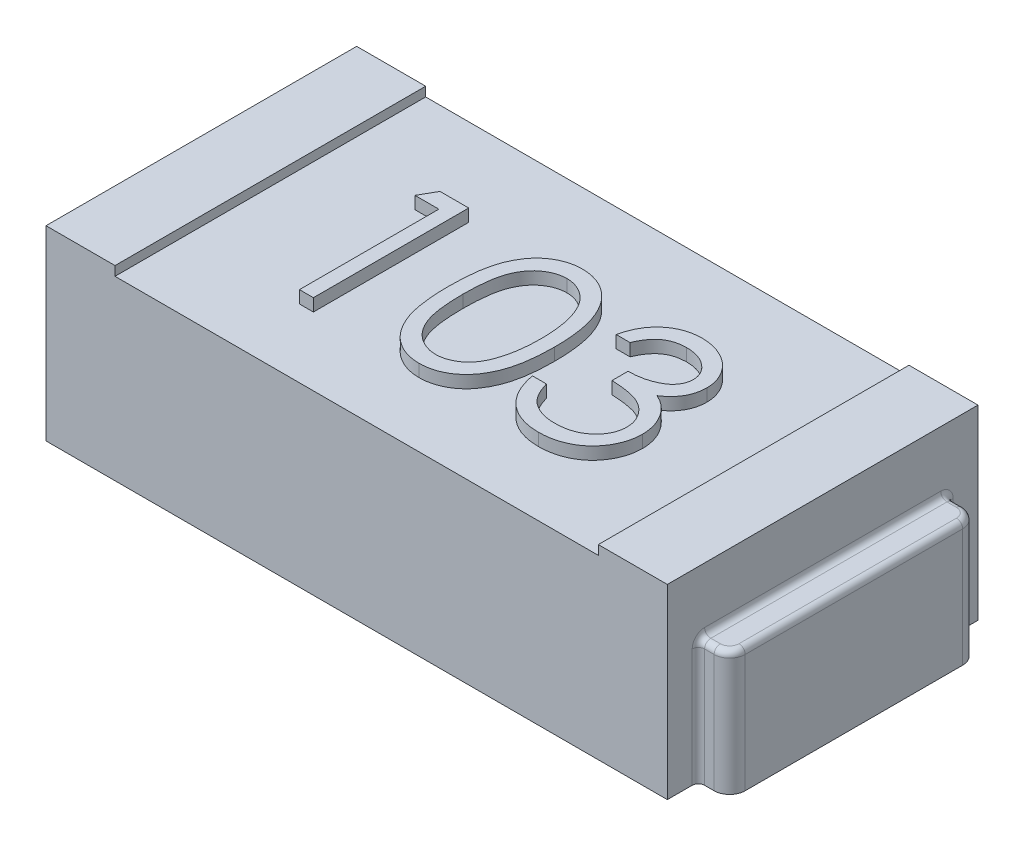
from build123d import *

# Parameters (mm, degrees)
ESQUISSE1_W             = 2
ESQUISSE1_H             = 1
BOSS_EXTRU_1_DEPTH      = 0.6
ESQUISSE2_W             = 1.555645222
ESQUISSE2_H             = 1
ENL_V_MAT_EXTRU_1_DEPTH = 0.03
BOSS_EXTRU_2_DEPTH      = 0.4
CONG_1_R                = 0.02
CONG_1_OF_SYM_TRIE2_R   = 0.02
BOSS_EXTRU_3_DEPTH      = 0.04


with BuildPart() as part:
    # Esquisse1 → Boss.-Extru.1 (new body)
    with BuildSketch(Plane(origin=(0, 0, 0), x_dir=(1, 0, 0), z_dir=(0, 1, 0))):
        Rectangle(ESQUISSE1_W, ESQUISSE1_H)
    extrude(amount=BOSS_EXTRU_1_DEPTH)

    # Esquisse2 → Enlèv. mat.-Extru.1 (cut)
    with BuildSketch(Plane(origin=(0, 0.6, 0), x_dir=(1, 0, 0), z_dir=(0, 1, 0))):
        Rectangle(ESQUISSE2_W, ESQUISSE2_H)
    extrude(amount=-ENL_V_MAT_EXTRU_1_DEPTH, mode=Mode.SUBTRACT)

    # Esquisse3 → Boss.-Extru.2 (add)
    with BuildSketch(Plane(origin=(0, 0, 0), x_dir=(1, 0, 0), z_dir=(0, 1, 0))):
        with BuildLine():
            Line((1, 0.4), (1.050552667, 0.4))
            ThreePointArc((1.050552667, 0.4), (1.085908006, 0.385355339), (1.100552667, 0.35))
            Line((1.100552667, 0.35), (1.100552667, -0.35))
            ThreePointArc((1.100552667, -0.35), (1.085908006, -0.385355339), (1.050552667, -0.4))
            Line((1.050552667, -0.4), (1, -0.4))
            Line((1, -0.4), (1, 0.4))
        make_face()
    boss_extru_2 = extrude(amount=BOSS_EXTRU_2_DEPTH)

    # Congé1
    cong_1_edges = [part.edges().sort_by_distance(p)[0] for p in [
        (1, 0.2, -0.4),
        (1, 0.2, 0.4),
        (1, 0.4, 0),
        (1.025276334, 0.4, 0.4),
        (1.085908006, 0.4, 0.385355339),
        (1.100552667, 0.4, 0),
        (1.085908006, 0.4, -0.385355339),
        (1.025276334, 0.4, -0.4),
    ]]
    fillet(cong_1_edges, radius=CONG_1_R)

    # Symétrie2: Boss.-Extru.2 across plane
    add(boss_extru_2.mirror(Plane(origin=(0, 0, 0), x_dir=(0, 0, 1), z_dir=(1, 0, 0))))

    # Congé1 of Symétrie2
    cong_1_of_sym_trie2_edges = [part.edges().sort_by_distance(p)[0] for p in [
        (-1, 0.2, -0.4),
        (-1, 0.2, 0.4),
        (-1, 0.4, 0),
        (-1.025276334, 0.4, 0.4),
        (-1.085908006, 0.4, 0.385355339),
        (-1.100552667, 0.4, 0),
        (-1.085908006, 0.4, -0.385355339),
        (-1.025276334, 0.4, -0.4),
    ]]
    fillet(cong_1_of_sym_trie2_edges, radius=CONG_1_OF_SYM_TRIE2_R)

    # Esquisse4 → Boss.-Extru.3 (add)
    # profile 1 of 3: a face of its own
    with BuildSketch(Plane(origin=(0, 0.57, 0), x_dir=(1, 0, 0), z_dir=(0, 1, 0))):
        with BuildLine():
            Line((0.275641026, 0.104315862), (0.230769231, 0.104315862))
            add(Edge.make_bspline(
                [(0.230769231, 0.104315862), (0.231984881, 0.109349074), (0.234361377, 0.119188592), (0.239318174, 0.133246772), (0.244718067, 0.146550132), (0.251202225, 0.158849571), (0.258274904, 0.170392272), (0.26637815, 0.180916432), (0.27513811, 0.190689713), (0.284827389, 0.199363033), (0.294988626, 0.207216994), (0.305765001, 0.213913431), (0.3169397, 0.219674024), (0.328590147, 0.224419771), (0.340751029, 0.227994846), (0.353312404, 0.230588676), (0.366307189, 0.23227312), (0.375128274, 0.232437515), (0.379607372, 0.23252099)],
                knots=[0, 0, 0, 0, 1.162005537, 2.271625781, 3.343758855, 4.383309926, 5.390229558, 6.379919256, 7.361854164, 8.333198761, 9.295911338, 10.242430842, 11.177959212, 12.116337295, 13.062827104, 14.020064771, 14.994644689, 16, 16, 16, 16], degree=3))
            add(Edge.make_bspline(
                [(0.379607372, 0.23252099), (0.386133478, 0.232323957), (0.399043337, 0.231934189), (0.418009486, 0.228374984), (0.436299032, 0.222742822), (0.453711781, 0.214960861), (0.469885843, 0.205362674), (0.484276727, 0.19393914), (0.496689371, 0.180910668), (0.507102854, 0.166520302), (0.515256425, 0.151140943), (0.521268764, 0.13531235), (0.524929004, 0.119072068), (0.52540337, 0.108106742), (0.525641026, 0.102613138)],
                knots=[0, 0, 0, 0, 1.083050992, 2.142477498, 3.193116406, 4.255571735, 5.30263384, 6.308962982, 7.297363603, 8.282367274, 9.249857812, 10.179914175, 11.08814088, 12, 12, 12, 12], degree=3))
            add(Edge.make_bspline(
                [(0.525641026, 0.102613138), (0.525474798, 0.097326453), (0.525149517, 0.086981231), (0.522387559, 0.07187816), (0.517739522, 0.057643645), (0.511300984, 0.044217765), (0.502966477, 0.031685645), (0.492870378, 0.020019089), (0.480941426, 0.009166352), (0.471901578, 0.002949285), (0.467247596, -0.000251446)],
                knots=[0, 0, 0, 0, 1.024540389, 2.004866551, 2.965041327, 3.920577974, 4.882998113, 5.874504559, 6.905732034, 8, 8, 8, 8], degree=3))
            add(Edge.make_bspline(
                [(0.467247596, -0.000251446), (0.472566418, -0.002819756), (0.483104543, -0.007908321), (0.497468904, -0.017887715), (0.510508601, -0.029410051), (0.517780561, -0.038401858), (0.521434295, -0.042919715)],
                knots=[0, 0, 0, 0, 1.015518401, 2.012035669, 3.001164323, 4, 4, 4, 4], degree=3))
            add(Edge.make_bspline(
                [(0.521434295, -0.042919715), (0.523840201, -0.046213679), (0.528612615, -0.052747668), (0.534503405, -0.063252871), (0.539847564, -0.073874513), (0.544011881, -0.084897285), (0.54723672, -0.09619343), (0.549541867, -0.107782343), (0.550973887, -0.119673489), (0.551178966, -0.127718129), (0.551282051, -0.131761862)],
                knots=[0, 0, 0, 0, 1.025084078, 2.033381695, 3.024893161, 4.013698104, 4.991890475, 5.976764909, 6.982997093, 8, 8, 8, 8], degree=3))
            add(Edge.make_bspline(
                [(0.551282051, -0.131761862), (0.551025692, -0.138763251), (0.55051418, -0.15273308), (0.54594217, -0.173372326), (0.538854564, -0.193547398), (0.528789287, -0.212843803), (0.516522501, -0.230898143), (0.501928597, -0.247051902), (0.485173396, -0.260937417), (0.466486875, -0.272538878), (0.446241571, -0.281812867), (0.424587915, -0.288249644), (0.401837907, -0.29244193), (0.386236864, -0.292891483), (0.378305288, -0.293120035)],
                knots=[0, 0, 0, 0, 0.955779014, 1.907060117, 2.875433937, 3.871313158, 4.872415639, 5.851225146, 6.836215519, 7.83643374, 8.849228613, 9.86973379, 10.916971861, 12, 12, 12, 12], degree=3))
            add(Edge.make_bspline(
                [(0.378305288, -0.293120035), (0.372959674, -0.292996005), (0.362441288, -0.292751954), (0.346977931, -0.291083583), (0.332217688, -0.288036439), (0.318140603, -0.283935967), (0.304734169, -0.278737147), (0.292039297, -0.272263047), (0.279977883, -0.264647118), (0.268663747, -0.255799463), (0.258098238, -0.245902128), (0.248562134, -0.234779413), (0.23989645, -0.222636926), (0.232333215, -0.209333633), (0.225527937, -0.195041453), (0.219930657, -0.179577382), (0.215004147, -0.163079664), (0.212713652, -0.151582844), (0.211538462, -0.145684138)],
                knots=[0, 0, 0, 0, 1.048658725, 2.063410685, 3.046034179, 4.001477787, 4.936774919, 5.862367409, 6.792675028, 7.730719943, 8.675894397, 9.627829632, 10.600096036, 11.597688215, 12.626045268, 13.701542398, 14.82072376, 16, 16, 16, 16], degree=3))
            Line((0.211538462, -0.145684138), (0.256410256, -0.145684138))
            add(Edge.make_bspline(
                [(0.256410256, -0.145684138), (0.257579298, -0.149533997), (0.259853186, -0.157022307), (0.2637238, -0.167799494), (0.268133553, -0.177679216), (0.272864204, -0.186733947), (0.277832553, -0.195052862), (0.283391828, -0.202415986), (0.289130278, -0.209146729), (0.2934559, -0.212938817), (0.295572917, -0.214794715)],
                knots=[0, 0, 0, 0, 1.198163088, 2.33053128, 3.407730985, 4.417276592, 5.372219308, 6.28897303, 7.162600585, 8, 8, 8, 8], degree=3))
            add(Edge.make_bspline(
                [(0.295572917, -0.214794715), (0.298372428, -0.216953048), (0.303962808, -0.221263053), (0.313072555, -0.226763286), (0.322653253, -0.231529146), (0.332912492, -0.235169674), (0.343628888, -0.238252197), (0.354975655, -0.240269414), (0.366852686, -0.241653439), (0.374962366, -0.241775572), (0.379106571, -0.241837984)],
                knots=[0, 0, 0, 0, 0.946170439, 1.889420265, 2.845303464, 3.807233317, 4.801018734, 5.828864929, 6.890507805, 8, 8, 8, 8], degree=3))
            add(Edge.make_bspline(
                [(0.379106571, -0.241837984), (0.383785642, -0.241749998), (0.392935163, -0.241577948), (0.406285857, -0.239995704), (0.418986921, -0.237691359), (0.430897339, -0.234132362), (0.442173126, -0.229735097), (0.452656219, -0.224213896), (0.462484234, -0.217736079), (0.471531292, -0.210373342), (0.479666365, -0.202313128), (0.486829152, -0.19388269), (0.49291839, -0.185117571), (0.497830329, -0.175969268), (0.501708979, -0.166475664), (0.504349437, -0.156610117), (0.506185367, -0.146453365), (0.506334883, -0.139549226), (0.506410256, -0.136068753)],
                knots=[0, 0, 0, 0, 1.217147791, 2.380027433, 3.494444702, 4.572153297, 5.609568379, 6.639424714, 7.649109417, 8.668170816, 9.669597737, 10.625200337, 11.543417969, 12.441394052, 13.322311151, 14.205496177, 15.095365482, 16, 16, 16, 16], degree=3))
            add(Edge.make_bspline(
                [(0.506410256, -0.136068753), (0.506191642, -0.131409991), (0.505755501, -0.122115647), (0.502425704, -0.108441707), (0.496948723, -0.095266934), (0.489281221, -0.082816107), (0.479947546, -0.071276693), (0.469038273, -0.060980767), (0.456462812, -0.052485039), (0.444888545, -0.046615231), (0.43463638, -0.042609935), (0.425862754, -0.039942083), (0.416040382, -0.037682989), (0.405288046, -0.035581236), (0.39352473, -0.033792472), (0.380763238, -0.032300784), (0.367000987, -0.031107207), (0.357473677, -0.030574193), (0.352564103, -0.030299523)],
                knots=[0, 0, 0, 0, 1.07054697, 2.135767047, 3.216561865, 4.33974944, 5.486079747, 6.621378074, 7.775625952, 8.963672916, 9.598146892, 10.304877434, 11.070270905, 11.915000392, 12.823868403, 13.805723172, 14.86925407, 16, 16, 16, 16], degree=3))
            Line((0.352564103, -0.030299523), (0.352564103, 0.020982529))
            add(Edge.make_bspline(
                [(0.352564103, 0.020982529), (0.358749983, 0.021087501), (0.370866604, 0.021293115), (0.388565791, 0.023779974), (0.40549055, 0.027220063), (0.421265798, 0.032489376), (0.435644186, 0.038609419), (0.448118415, 0.045731163), (0.458513722, 0.053647556), (0.466779589, 0.062480786), (0.47299805, 0.071954364), (0.477544736, 0.081828172), (0.480230497, 0.092188752), (0.48058902, 0.099259419), (0.480769231, 0.102813458)],
                knots=[0, 0, 0, 0, 1.321986639, 2.589447074, 3.816329219, 5.01088745, 6.139805852, 7.153945165, 8.075214402, 8.924034688, 9.728124013, 10.488707548, 11.240355623, 12, 12, 12, 12], degree=3))
            add(Edge.make_bspline(
                [(0.480769231, 0.102813458), (0.480710029, 0.105424565), (0.48059225, 0.110619237), (0.479106925, 0.118208533), (0.476874919, 0.125565811), (0.473806386, 0.132659783), (0.469699215, 0.139441251), (0.464784074, 0.14596803), (0.458931489, 0.152202855), (0.452224996, 0.158014329), (0.44502331, 0.163552792), (0.437130485, 0.16825474), (0.428784503, 0.172275463), (0.419976123, 0.175591106), (0.410676762, 0.17808529), (0.400930111, 0.179876125), (0.390717585, 0.18099579), (0.383750194, 0.181156992), (0.380208333, 0.181238939)],
                knots=[0, 0, 0, 0, 0.884392785, 1.759457502, 2.611959086, 3.489218968, 4.37281399, 5.2945488, 6.255912374, 7.266815255, 8.301784654, 9.332968512, 10.37626691, 11.440494194, 12.520033166, 13.637162961, 14.798855837, 16, 16, 16, 16], degree=3))
            add(Edge.make_bspline(
                [(0.380208333, 0.181238939), (0.374515238, 0.181040173), (0.363395298, 0.180651937), (0.347364596, 0.177251506), (0.332461834, 0.171826066), (0.321070596, 0.16534992), (0.3126588, 0.158957001), (0.306647808, 0.153373803), (0.300744878, 0.147169114), (0.295338353, 0.139960774), (0.289870642, 0.132236947), (0.284892848, 0.123604993), (0.280055749, 0.114290079), (0.277141099, 0.107704989), (0.275641026, 0.104315862)],
                knots=[0, 0, 0, 0, 1.472543308, 2.876219568, 4.221790263, 5.565193594, 6.249813518, 6.953379497, 7.687249741, 8.463570142, 9.283606569, 10.136032583, 11.040678096, 12, 12, 12, 12], degree=3))
        make_face()
    # profile 2 of 3: a face of its own
    with BuildSketch(Plane(origin=(0, 0.57, 0), x_dir=(1, 0, 0), z_dir=(0, 1, 0))):
        with BuildLine():
            add(Edge.make_bspline(
                [(-0.173076923, -0.030499843), (-0.173030063, -0.022485931), (-0.172939038, -0.00691879), (-0.171926406, 0.01576473), (-0.170244214, 0.037044772), (-0.167938875, 0.056922352), (-0.16513345, 0.075402605), (-0.16138838, 0.092436141), (-0.157129408, 0.108101799), (-0.152193345, 0.122450663), (-0.14662366, 0.13567605), (-0.140561623, 0.148022507), (-0.133766653, 0.159471354), (-0.126627094, 0.170205324), (-0.11885394, 0.180048709), (-0.110668399, 0.189140518), (-0.101750988, 0.197270626), (-0.092404844, 0.20467724), (-0.082545349, 0.211170022), (-0.07245354, 0.216888984), (-0.062059953, 0.22177468), (-0.051336213, 0.225616171), (-0.040378704, 0.228789149), (-0.029149123, 0.230958998), (-0.017628929, 0.232324271), (-0.009853009, 0.232454795), (-0.005909455, 0.23252099)],
                knots=[0, 0, 0, 0, 1.646270934, 3.197905019, 4.663502075, 6.030701355, 7.308322542, 8.50163776, 9.611534131, 10.641858119, 11.616356847, 12.558055219, 13.465016945, 14.349605745, 15.204443733, 16.039544428, 16.859896111, 17.680448484, 18.487036065, 19.28249412, 20.06191084, 20.843045899, 21.620316918, 22.403196591, 23.190181807, 24, 24, 24, 24], degree=3))
            add(Edge.make_bspline(
                [(-0.005909455, 0.23252099), (-0.001932958, 0.232451302), (0.005975043, 0.232312715), (0.017666525, 0.230980723), (0.029087908, 0.228770563), (0.0401905, 0.225638995), (0.051065498, 0.221753898), (0.061627842, 0.21688431), (0.071943139, 0.211215901), (0.081847466, 0.204555347), (0.091449554, 0.197129307), (0.100513548, 0.18873464), (0.109040275, 0.179456109), (0.117136747, 0.169392986), (0.124573261, 0.158352259), (0.13165518, 0.146525958), (0.137994042, 0.133707263), (0.144098996, 0.120110053), (0.149368565, 0.105358102), (0.154120886, 0.089534565), (0.157960739, 0.072452538), (0.161159206, 0.054201646), (0.163637048, 0.034714862), (0.165441712, 0.01403396), (0.16639501, -0.007854667), (0.166574538, -0.022820074), (0.166666667, -0.030499843)],
                knots=[0, 0, 0, 0, 0.810914788, 1.612654377, 2.396697861, 3.181598691, 3.963628158, 4.749916497, 5.551656086, 6.361998678, 7.18212741, 8.025565596, 8.878627764, 9.750805457, 10.657531673, 11.591944965, 12.560506719, 13.57287815, 14.630710178, 15.753379473, 16.941251878, 18.199788006, 19.531962791, 20.947069417, 22.433333509, 24, 24, 24, 24], degree=3))
            add(Edge.make_bspline(
                [(0.166666667, -0.030499843), (0.166573583, -0.038146116), (0.166392214, -0.053044566), (0.165452398, -0.074834705), (0.163601165, -0.095405854), (0.161285453, -0.114807349), (0.158078172, -0.132958437), (0.154134577, -0.14992193), (0.14975596, -0.165771083), (0.144350989, -0.180376056), (0.138435173, -0.193940588), (0.131998717, -0.206607324), (0.125103027, -0.218488222), (0.117590349, -0.229488186), (0.109582719, -0.239685137), (0.100908749, -0.248899083), (0.091812951, -0.257352037), (0.082182606, -0.264873698), (0.072123813, -0.271457241), (0.061843945, -0.277344934), (0.051160605, -0.282092462), (0.040315897, -0.286168896), (0.029154702, -0.289283247), (0.017690932, -0.291436655), (0.005982898, -0.292946919), (-0.001931611, -0.29306213), (-0.005909455, -0.293120035)],
                knots=[0, 0, 0, 0, 1.561518951, 3.042555995, 4.452378317, 5.7783523, 7.031515105, 8.214008947, 9.334062868, 10.386615937, 11.391082383, 12.354592575, 13.286541444, 14.194233754, 15.072674879, 15.931287219, 16.775624067, 17.606195743, 18.42308326, 19.229000347, 20.022332153, 20.807536673, 21.593273796, 22.3848459, 23.188221202, 24, 24, 24, 24], degree=3))
            add(Edge.make_bspline(
                [(-0.005909455, -0.293120035), (-0.0098529, -0.293053413), (-0.017628604, -0.292922047), (-0.029150379, -0.291562943), (-0.040333585, -0.289377871), (-0.051233407, -0.286318356), (-0.061905766, -0.282573379), (-0.072205236, -0.277694282), (-0.082246333, -0.272075129), (-0.09200227, -0.265675783), (-0.101289721, -0.258344114), (-0.110160951, -0.25023493), (-0.118393096, -0.241145871), (-0.12605511, -0.231220454), (-0.133337123, -0.22054999), (-0.140035605, -0.208988794), (-0.146231441, -0.196582707), (-0.151894797, -0.183251577), (-0.156916034, -0.168800873), (-0.161351421, -0.153065276), (-0.164853444, -0.135905899), (-0.167851009, -0.117460561), (-0.170268778, -0.09765), (-0.171919396, -0.07646346), (-0.172939583, -0.053914145), (-0.173030308, -0.038447034), (-0.173076923, -0.030499843)],
                knots=[0, 0, 0, 0, 0.810891512, 1.598919785, 2.382837074, 3.152667961, 3.926044502, 4.706494248, 5.493654104, 6.291793342, 7.103789334, 7.925228297, 8.761435821, 9.622817696, 10.50288917, 11.416980706, 12.369136599, 13.353924996, 14.394355917, 15.514179734, 16.714354668, 17.994756427, 19.357759367, 20.818452758, 22.365282078, 24, 24, 24, 24], degree=3))
        make_face()
        with BuildLine():
            add(Edge.make_bspline(
                [(-0.128205128, -0.030299523), (-0.128188064, -0.036977908), (-0.128154947, -0.049939343), (-0.127289775, -0.068774095), (-0.126111171, -0.086341285), (-0.124590985, -0.102663218), (-0.122333421, -0.117684649), (-0.11980388, -0.131508889), (-0.116725582, -0.14406278), (-0.113083436, -0.155432467), (-0.108934994, -0.165810906), (-0.104405585, -0.175468222), (-0.099539767, -0.184518499), (-0.094094174, -0.192880443), (-0.088163451, -0.200581323), (-0.081881557, -0.207757442), (-0.075014045, -0.214157011), (-0.06551351, -0.221832276), (-0.052971157, -0.229763581), (-0.037168234, -0.236670165), (-0.020929884, -0.241010516), (-0.009908277, -0.241562481), (-0.004407051, -0.241837984)],
                knots=[0, 0, 0, 0, 1.459021318, 2.831673884, 4.118529203, 5.306027144, 6.411944654, 7.436330062, 8.375795394, 9.233974572, 10.042671642, 10.816086306, 11.563610507, 12.285937304, 12.993564865, 13.685989202, 14.367179055, 15.041617293, 16.353048772, 17.594441528, 18.799311195, 20, 20, 20, 20], degree=3))
            add(Edge.make_bspline(
                [(-0.004407051, -0.241837984), (0.001129759, -0.24160973), (0.012191948, -0.241153692), (0.028353919, -0.236753873), (0.044043957, -0.230115367), (0.056339949, -0.222265723), (0.065694598, -0.214790248), (0.072397025, -0.208416726), (0.078548746, -0.201280174), (0.084383328, -0.193580275), (0.089734625, -0.18516992), (0.094600787, -0.176089552), (0.099041266, -0.166313955), (0.101571129, -0.159489707), (0.102864583, -0.156000644)],
                knots=[0, 0, 0, 0, 1.353760809, 2.704726607, 4.075137775, 5.516104923, 6.260822281, 7.007110065, 7.778089737, 8.566572457, 9.372053459, 10.217411131, 11.088608312, 12, 12, 12, 12], degree=3))
            add(Edge.make_bspline(
                [(0.102864583, -0.156000644), (0.104371979, -0.151539253), (0.107432638, -0.142480715), (0.111377177, -0.128428765), (0.114483663, -0.113685513), (0.117278429, -0.098339068), (0.119186009, -0.082276253), (0.12072141, -0.06554677), (0.121625794, -0.048138004), (0.121737902, -0.036310148), (0.121794872, -0.030299523)],
                knots=[0, 0, 0, 0, 0.884706709, 1.796334032, 2.740027952, 3.714592787, 4.726048262, 5.777819803, 6.87074269, 8, 8, 8, 8], degree=3))
            add(Edge.make_bspline(
                [(0.121794872, -0.030299523), (0.121716273, -0.024289869), (0.121562518, -0.012533703), (0.120974805, 0.00468318), (0.119457152, 0.021035717), (0.117771564, 0.036594356), (0.115286246, 0.051272971), (0.11260656, 0.065194443), (0.109006386, 0.078186304), (0.105160704, 0.090451958), (0.100759219, 0.101852052), (0.095914114, 0.112439736), (0.090739577, 0.122266125), (0.085119257, 0.131304259), (0.079119874, 0.139594623), (0.072583081, 0.146970993), (0.065768171, 0.153661989), (0.056222858, 0.161299499), (0.043726531, 0.169086884), (0.028177153, 0.176253421), (0.011995633, 0.180368891), (0.001056568, 0.180949132), (-0.004407051, 0.181238939)],
                knots=[0, 0, 0, 0, 1.31362396, 2.569729283, 3.763502607, 4.902122613, 5.988968491, 7.01645872, 7.998833611, 8.933434873, 9.825090667, 10.667526885, 11.477055099, 12.250526234, 12.991942729, 13.710640831, 14.402115721, 15.076753259, 16.378508321, 17.609869233, 18.806226677, 20, 20, 20, 20], degree=3))
            add(Edge.make_bspline(
                [(-0.004407051, 0.181238939), (-0.009937136, 0.180948732), (-0.02100738, 0.18036779), (-0.037357087, 0.176268754), (-0.053029138, 0.169124045), (-0.06549242, 0.161273706), (-0.075044389, 0.153796804), (-0.081770488, 0.147313025), (-0.088077084, 0.140220703), (-0.093886756, 0.132449001), (-0.099328082, 0.124096805), (-0.104325369, 0.11509841), (-0.108827845, 0.105408216), (-0.112982779, 0.095034439), (-0.116636034, 0.083665733), (-0.119649458, 0.071127305), (-0.122433322, 0.057347035), (-0.124404075, 0.042244248), (-0.12615604, 0.025918226), (-0.127281947, 0.008307181), (-0.128157841, -0.01055916), (-0.12818905, -0.023587611), (-0.128205128, -0.030299523)],
                knots=[0, 0, 0, 0, 1.207732386, 2.417664972, 3.655092373, 4.956220595, 5.625982001, 6.301752483, 6.994047911, 7.697131622, 8.419323945, 9.170223765, 9.943494443, 10.752040957, 11.610060368, 12.549350801, 13.567764191, 14.679664412, 15.874934091, 17.154273443, 18.533957287, 20, 20, 20, 20], degree=3))
        make_face(mode=Mode.SUBTRACT)
    # profile 3 of 3: a face of its own
    with BuildSketch(Plane(origin=(0, 0.57, 0), x_dir=(1, 0, 0), z_dir=(0, 1, 0))):
        Polygon((-0.451422276, 0.219700477), (-0.358974359, 0.219700477), (-0.358974359, -0.280299523), (-0.403846154, -0.280299523), (-0.403846154, 0.168418426), (-0.480769231, 0.168418426), align=None)
    extrude(amount=BOSS_EXTRU_3_DEPTH)


solid = part.part
